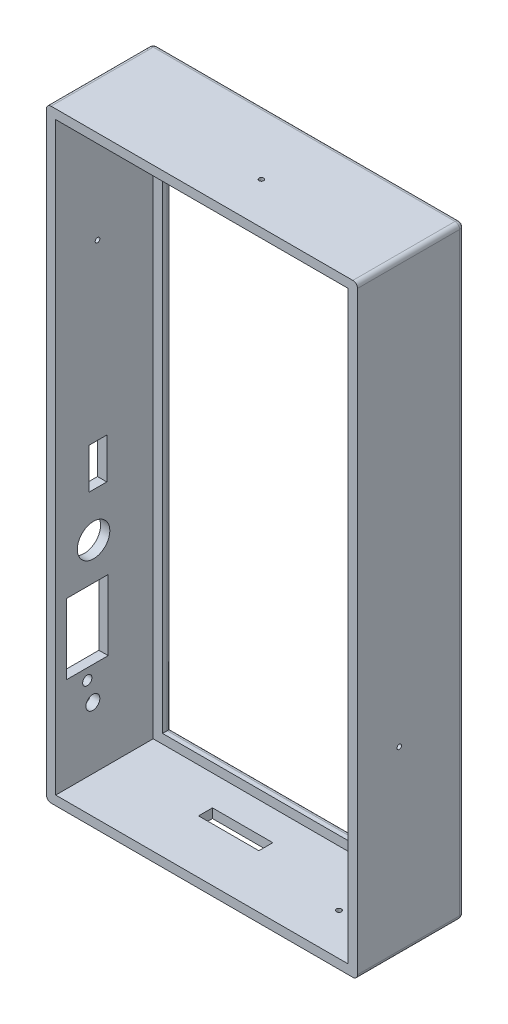
from build123d import *

# Parameters (mm, degrees)
SCHIZZO1_W                    = 67
SCHIZZO1_H                    = 130
ESTRUSIONE_ESTRUSIONE1_DEPTH  = 23
SCHIZZO2_W                    = 63
SCHIZZO2_H                    = 126
TAGLIO_ESTRUSIONE1_DEPTH      = 21
TAGLIO_ESTRUSIONE2_DEPTH      = 77.08054942
TAGLIO_ESTRUSIONE2_DEPTH_BACK = 77.08054942
SCHIZZO3_W                    = 59
SCHIZZO3_H                    = 122
TAGLIO_ESTRUSIONE4_REACH      = 98.141
SCHIZZO4_R                    = 1.5
SCHIZZO4_R_2                  = 3.5
SCHIZZO4_R_3                  = 1
SCHIZZO4_W                    = 9
SCHIZZO4_H                    = 15.14
SCHIZZO4_W_2                  = 3.83
SCHIZZO4_H_2                  = 8.75
TAGLIO_ESTRUSIONE5_REACH      = 138.203
SCHIZZO5_W                    = 13
SCHIZZO5_H                    = 3
RACCORDO1_R                   = 1
TAGLIO_ESTRUSIONE6_REACH      = 98.141
SCHIZZO6_R                    = 0.5
SCHIZZO7_R                    = 0.5
TAGLIO_ESTRUSIONE7_DEPTH      = 10
SCHIZZO8_R                    = 0.5
TAGLIO_ESTRUSIONE8_DEPTH      = 10
SCHIZZO9_R                    = 0.54
TAGLIO_ESTRUSIONE9_DEPTH      = 10


with BuildPart() as part:
    # Schizzo1 → Estrusione-Estrusione1 (new body)
    with BuildSketch(Plane.XY):
        Rectangle(SCHIZZO1_W, SCHIZZO1_H)
    extrude(amount=ESTRUSIONE_ESTRUSIONE1_DEPTH)

    # Schizzo2 → Taglio-Estrusione1 (cut)
    with BuildSketch(Plane.XY.offset(23)):
        Rectangle(SCHIZZO2_W, SCHIZZO2_H)
    extrude(amount=-TAGLIO_ESTRUSIONE1_DEPTH, mode=Mode.SUBTRACT)

    # Schizzo3 → Taglio-Estrusione2 (cut, two sides: drawn at the far end of the back side and taken through both)
    with BuildSketch(Plane.XY.offset(2).offset(-TAGLIO_ESTRUSIONE2_DEPTH_BACK)):
        Rectangle(SCHIZZO3_W, SCHIZZO3_H)
    extrude(amount=TAGLIO_ESTRUSIONE2_DEPTH + TAGLIO_ESTRUSIONE2_DEPTH_BACK, mode=Mode.SUBTRACT)

    # Schizzo4 → Taglio-Estrusione4 (cut, up to next)
    with BuildSketch(Plane.ZY.offset(33.5), mode=Mode.PRIVATE) as taglio_estrusione4_sk1:
        with Locations((15, -49.7)):
            Circle(SCHIZZO4_R)
    taglio_estrusione4_tool1 = extrude(taglio_estrusione4_sk1.sketch, amount=-TAGLIO_ESTRUSIONE4_REACH, mode=Mode.PRIVATE) & part.part
    # Schizzo4 → Taglio-Estrusione4 (cut, up to next)
    with BuildSketch(Plane.ZY.offset(33.5), mode=Mode.PRIVATE) as taglio_estrusione4_sk2:
        with Locations((14.85, -19.5)):
            Circle(SCHIZZO4_R_2)
    taglio_estrusione4_tool2 = extrude(taglio_estrusione4_sk2.sketch, amount=-TAGLIO_ESTRUSIONE4_REACH, mode=Mode.PRIVATE) & part.part
    # Schizzo4 → Taglio-Estrusione4 (cut, up to next)
    with BuildSketch(Plane.ZY.offset(33.5), mode=Mode.PRIVATE) as taglio_estrusione4_sk3:
        with Locations((16.2, -44.99254441)):
            Circle(SCHIZZO4_R_3)
    taglio_estrusione4_tool3 = extrude(taglio_estrusione4_sk3.sketch, amount=-TAGLIO_ESTRUSIONE4_REACH, mode=Mode.PRIVATE) & part.part
    # Schizzo4 → Taglio-Estrusione4 (cut, up to next)
    with BuildSketch(Plane.ZY.offset(33.5), mode=Mode.PRIVATE) as taglio_estrusione4_sk4:
        with Locations((16.2, -35.07)):
            Rectangle(SCHIZZO4_W, SCHIZZO4_H)
    taglio_estrusione4_tool4 = extrude(taglio_estrusione4_sk4.sketch, amount=-TAGLIO_ESTRUSIONE4_REACH, mode=Mode.PRIVATE) & part.part
    # Schizzo4 → Taglio-Estrusione4 (cut, up to next)
    with BuildSketch(Plane.ZY.offset(33.5), mode=Mode.PRIVATE) as taglio_estrusione4_sk5:
        with Locations((13.915, -5.715)):
            Rectangle(SCHIZZO4_W_2, SCHIZZO4_H_2)
    taglio_estrusione4_tool5 = extrude(taglio_estrusione4_sk5.sketch, amount=-TAGLIO_ESTRUSIONE4_REACH, mode=Mode.PRIVATE) & part.part
    add(taglio_estrusione4_tool1.solids().sort_by_distance((-33.5, -49.7, 15))[0], mode=Mode.SUBTRACT)
    add(taglio_estrusione4_tool2.solids().sort_by_distance((-33.5, -19.5, 14.85))[0], mode=Mode.SUBTRACT)
    add(taglio_estrusione4_tool3.solids().sort_by_distance((-33.5, -44.992544, 16.2))[0], mode=Mode.SUBTRACT)
    add(taglio_estrusione4_tool4.solids().sort_by_distance((-33.5, -35.07, 16.2))[0], mode=Mode.SUBTRACT)
    add(taglio_estrusione4_tool5.solids().sort_by_distance((-33.5, -5.715, 13.915))[0], mode=Mode.SUBTRACT)

    # Schizzo5 → Taglio-Estrusione5 (cut, up to next)
    with BuildSketch(Plane.XZ.offset(65), mode=Mode.PRIVATE) as taglio_estrusione5_sk1:
        with Locations((-5.741459814, 10)):
            Rectangle(SCHIZZO5_W, SCHIZZO5_H)
    taglio_estrusione5_tool1 = extrude(taglio_estrusione5_sk1.sketch, amount=-TAGLIO_ESTRUSIONE5_REACH, mode=Mode.PRIVATE) & part.part
    add(taglio_estrusione5_tool1.solids().sort_by_distance((-5.74146, -65, 10))[0], mode=Mode.SUBTRACT)

    # Raccordo1
    raccordo1_edges = [part.edges().sort_by_distance(p)[0] for p in [
        (29.5, 0, 0),
        (0, -61, 0),
        (-29.5, 0, 0),
        (0, 61, 0),
        (0, -65, 0),
        (-33.5, 0, 0),
        (0, 65, 0),
        (33.5, 0, 0),
        (33.5, -65, 11.5),
        (-33.5, -65, 11.5),
        (-33.5, 65, 11.5),
        (33.5, 65, 11.5),
    ]]
    fillet(raccordo1_edges, radius=RACCORDO1_R)

    # Schizzo6 → Taglio-Estrusione6 (cut, up to next)
    with BuildSketch(Plane(origin=(33.5, 0, 0), x_dir=(0, 0, -1), z_dir=(1, 0, 0)), mode=Mode.PRIVATE) as taglio_estrusione6_sk1:
        with Locations(Location((-14, -26, 0), (0, 0, 90))):
            Circle(SCHIZZO6_R)
    taglio_estrusione6_tool1 = extrude(taglio_estrusione6_sk1.sketch, amount=-TAGLIO_ESTRUSIONE6_REACH, mode=Mode.PRIVATE) & part.part
    add(taglio_estrusione6_tool1.solids().sort_by_distance((33.5, -26, 14))[0], mode=Mode.SUBTRACT)

    # Schizzo7 → Taglio-Estrusione7 (cut)
    with BuildSketch(Plane(origin=(0, 65, 0), x_dir=(1, 0, 0), z_dir=(0, 1, 0))):
        with Locations(Location((3.81, -14, 0), (0, 0, 270))):
            Circle(SCHIZZO7_R)
    extrude(amount=-TAGLIO_ESTRUSIONE7_DEPTH, mode=Mode.SUBTRACT)

    # Schizzo8 → Taglio-Estrusione8 (cut)
    with BuildSketch(Plane.ZY.offset(33.5)):
        with Locations((14, 36)):
            Circle(SCHIZZO8_R)
    extrude(amount=-TAGLIO_ESTRUSIONE8_DEPTH, mode=Mode.SUBTRACT)

    # Schizzo9 → Taglio-Estrusione9 (cut)
    with BuildSketch(Plane.XZ.offset(65)):
        with Locations(Location((20.5, 14, 0), (0, 0, 270))):
            Circle(SCHIZZO9_R)
    extrude(amount=-TAGLIO_ESTRUSIONE9_DEPTH, mode=Mode.SUBTRACT)


solid = part.part
